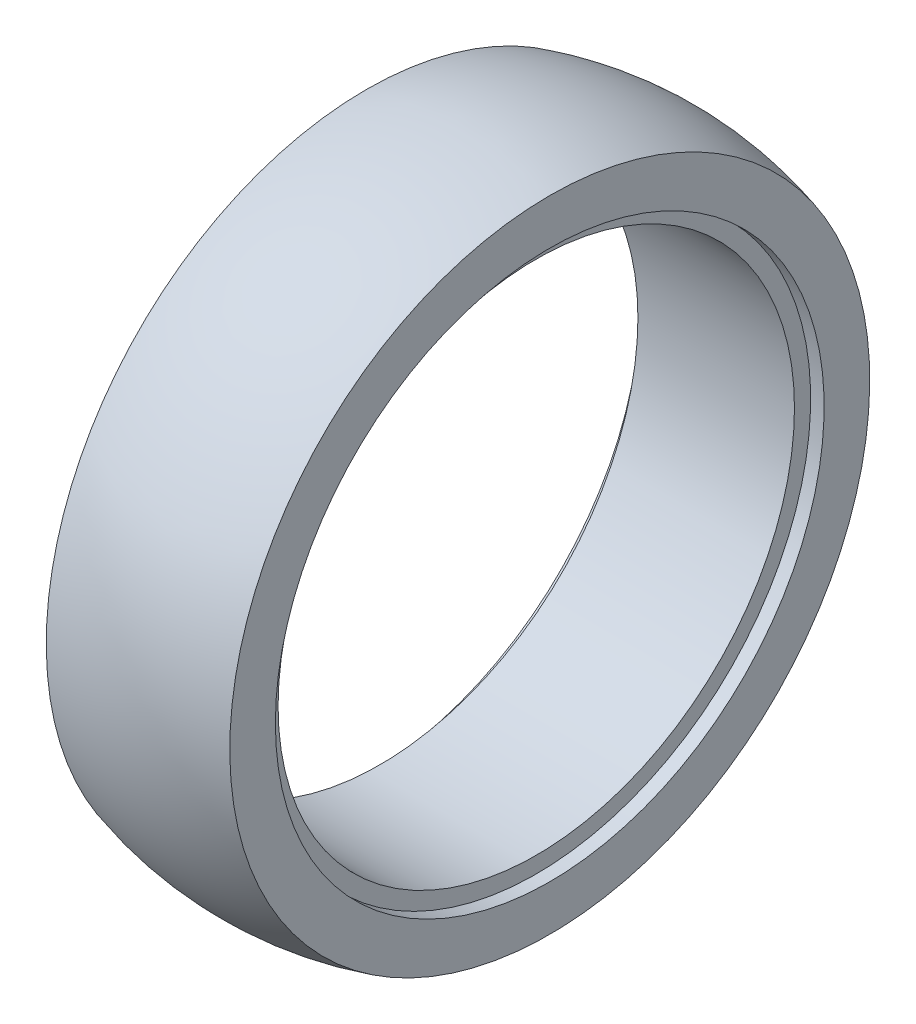
from build123d import *


with BuildPart() as part:
    # 草图1 → 旋转1 (revolve)
    with BuildSketch(Plane.XY, mode=Mode.PRIVATE) as revolve_1_sk:
        with BuildLine():
            Line((0, 76.25), (0, 71.75))
            Line((0, 71.75), (43.5, 71.75))
            Line((43.5, 71.75), (43.5, 76.25))
            Line((43.5, 76.25), (47.25, 76.25))
            Line((47.25, 76.25), (47.25, 88.915690404))
            ThreePointArc((47.25, 88.915690404), (34.625338065, 91.599539681), (21.7500009, 92.5))
            ThreePointArc((21.7500009, 92.5), (8.874662826, 91.599539806), (-3.75, 88.915690404))
            Line((-3.75, 88.915690404), (-3.75, 76.25))
            Line((-3.75, 76.25), (0, 76.25))
        make_face()
    revolve(revolve_1_sk.sketch.rotate(Axis((0, 0, 0), (1, 0, 0)), 90), axis=Axis((0, 0, 0), (1, 0, 0)))


solid = part.part
